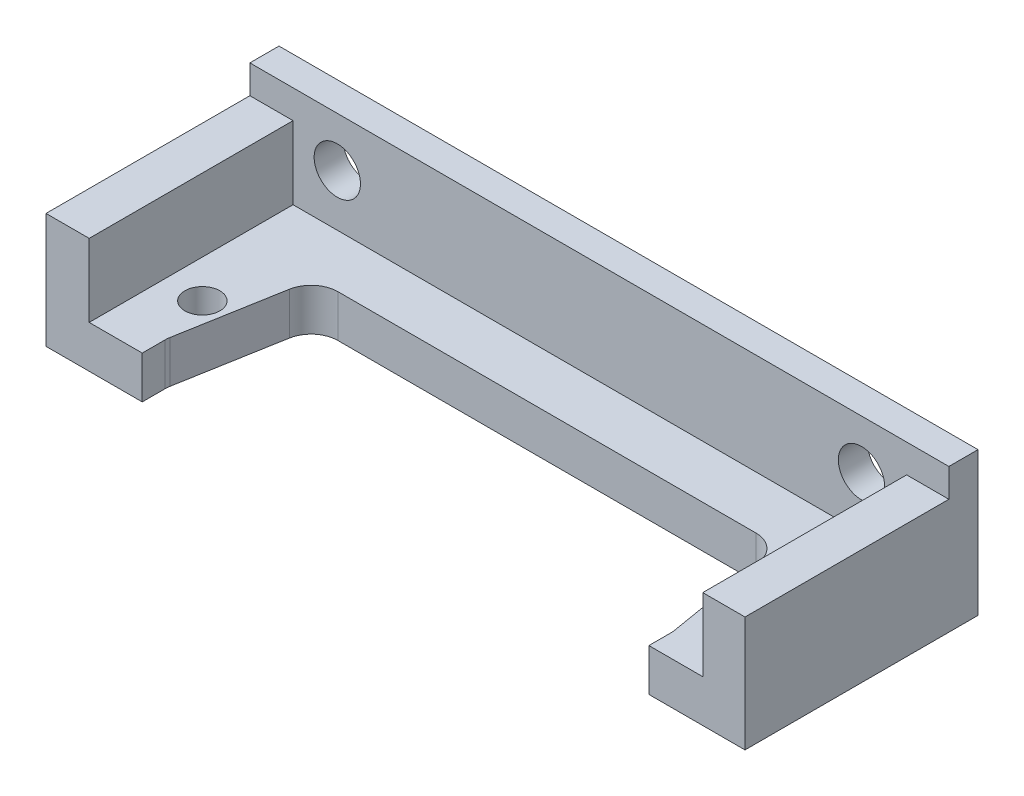
from build123d import *

# Parameters (mm, degrees)
SKETCH1_W           = 55.88
SKETCH1_H           = 9.981767046
SKETCH1_R           = 2.0193
BOSS_EXTRUDE1_DEPTH = 2.54
SKETCH2_W           = 55.88
SKETCH2_H           = 1.152145831
BOSS_EXTRUDE2_DEPTH = 17.78
SKETCH3_W           = 1.2265406
SKETCH3_H           = 17.78
SKETCH3_W_2         = 1.1438128
BOSS_EXTRUDE4_DEPTH = 6.35
SKETCH4_R           = 1.524
CUT_EXTRUDE1_DEPTH  = 105.035332272
CUT_EXTRUDE3_DEPTH  = 105.035332272
BOSS_EXTRUDE5_DEPTH = 2.54
BOSS_EXTRUDE6_DEPTH = 2.54
FILLET1_R           = 2.3368
FILLET2_R           = 2.3368
FILLET3_R           = 2.3368
FILLET4_R           = 2.3368
BOSS_EXTRUDE7_START = 2.54
SKETCH8_R           = 1.524
BOSS_EXTRUDE7_DEPTH = 2.54


with BuildPart() as part:
    # Sketch1 → Boss-Extrude1 (new body)
    with BuildSketch(Plane.XY):
        with Locations((-73.708835459, 211.206122276)):
            Rectangle(SKETCH1_W, SKETCH1_H)
        with Locations((-96.565388679, 211.879005799)):
            Circle(SKETCH1_R, mode=Mode.SUBTRACT)
        with Locations((-50.848835459, 211.879005799)):
            Circle(SKETCH1_R, mode=Mode.SUBTRACT)
    extrude(amount=BOSS_EXTRUDE1_DEPTH)

    # Sketch2 → Boss-Extrude2 (add)
    with BuildSketch(Plane.XY.offset(2.54)):
        with Locations((-73.708835459, 206.791311669)):
            Rectangle(SKETCH2_W, SKETCH2_H)
    extrude(amount=BOSS_EXTRUDE2_DEPTH)

    # Sketch3 → Boss-Extrude4 (add)
    with BuildSketch(Plane(origin=(0, 207.367384584, 0), x_dir=(1, 0, 0), z_dir=(0, 1, 0))):
        with Locations((-101.035565159, -11.43)):
            Rectangle(SKETCH3_W, SKETCH3_H)
        with Locations((-46.340741859, -11.43)):
            Rectangle(SKETCH3_W_2, SKETCH3_H)
    extrude(amount=BOSS_EXTRUDE4_DEPTH)

    # Sketch4 → Cut-Extrude1 (cut, through all)
    with BuildSketch(Plane(origin=(0, 207.367384584, 0), x_dir=(1, 0, 0), z_dir=(0, 1, 0))):
        with Locations(Location((-97.120294859, -13.7541, 0), (0, 0, 270))):
            Circle(SKETCH4_R)
        with Locations(Location((-50.214648259, -13.7541, 0), (0, 0, 270))):
            Circle(SKETCH4_R)
    extrude(amount=-CUT_EXTRUDE1_DEPTH, mode=Mode.SUBTRACT)

    # Sketch5 → Cut-Extrude3 (cut, through all)
    with BuildSketch(Plane(origin=(0, 207.367384584, 0), x_dir=(1, 0, 0), z_dir=(0, 1, 0))):
        Polygon((-53.474471559, -7.1501), (-93.860471559, -7.1501), (-95.795272253, -18.1229), (-95.795272253, -20.32), (-92.955896087, -20.32), (-62.921890572, -20.32), (-51.611648259, -20.32), (-51.611648259, -18.237455367), align=None)
    extrude(amount=-CUT_EXTRUDE3_DEPTH, mode=Mode.SUBTRACT)

    # Sketch6 → Boss-Extrude5 (add)
    with BuildSketch(Plane.ZY.offset(101.648835459)):
        Polygon((2.54, 216.197005799), (0, 216.197005799), (0, 206.215238753), (20.32, 206.215238753), (20.32, 213.717384584), (2.54, 213.717384584), align=None)
    extrude(amount=BOSS_EXTRUDE5_DEPTH)

    # Sketch7 → Boss-Extrude6 (add)
    with BuildSketch(Plane(origin=(-45.768835459, 0, 0), x_dir=(0, 0, -1), z_dir=(1, 0, 0))):
        Polygon((0, 216.197005799), (-2.54, 216.197005799), (-2.54, 213.717384584), (-20.32, 213.717384584), (-20.32, 206.215238753), (0, 206.215238753), align=None)
    extrude(amount=BOSS_EXTRUDE6_DEPTH)

    # Fillet1
    fillet1_edges = [part.edges().sort_by_distance(p)[0] for p in [
        (-93.860471559, 206.791311669, 7.1501),
    ]]
    fillet(fillet1_edges, radius=FILLET1_R)

    # Fillet2
    fillet2_edges = [part.edges().sort_by_distance(p)[0] for p in [
        (-53.474471559, 206.791311669, 7.1501),
    ]]
    fillet(fillet2_edges, radius=FILLET2_R)

    # Fillet3
    fillet3_edges = [part.edges().sort_by_distance(p)[0] for p in [
        (-95.795272253, 206.791311669, 18.1229),
    ]]
    fillet(fillet3_edges, radius=FILLET3_R)

    # Fillet4
    fillet4_edges = [part.edges().sort_by_distance(p)[0] for p in [
        (-51.611648259, 206.791311669, 18.237455367),
    ]]
    fillet(fillet4_edges, radius=FILLET4_R)

    # Sketch8 → Boss-Extrude7 (add)
    with BuildSketch(Plane.XZ.offset(-206.215238753).offset(BOSS_EXTRUDE7_START)):
        with BuildLine():
            Line((-55.451410668, 7.1501), (-91.899663541, 7.1501))
            ThreePointArc((-91.899663541, 7.1501), (-93.401729627, 7.696807345), (-94.200962298, 9.081118938))
            Line((-94.200962298, 9.081118938), (-95.75977101, 17.921562447))
            ThreePointArc((-95.75977101, 17.921562447), (-95.786380023, 18.123677969), (-95.795272253, 18.327343509))
            Line((-95.795272253, 18.327343509), (-95.795272253, 20.32))
            Line((-95.795272253, 20.32), (-104.188835459, 20.32))
            Line((-104.188835459, 20.32), (-104.188835459, 0))
            Line((-104.188835459, 0), (-43.228835459, 0))
            Line((-43.228835459, 0), (-43.228835459, 20.32))
            Line((-43.228835459, 20.32), (-51.611648259, 20.32))
            Line((-51.611648259, 20.32), (-51.611648259, 18.432395976))
            ThreePointArc((-51.611648259, 18.432395976), (-51.619737234, 18.238130166), (-51.64394816, 18.045209281))
            Line((-51.64394816, 18.045209281), (-53.14691057, 9.099713305))
            ThreePointArc((-53.14691057, 9.099713305), (-53.942129983, 7.702885971), (-55.451410668, 7.1501))
        make_face()
        with Locations(Location((-50.214648259, 13.7541, 0), (0, 0, 90))):
            Circle(SKETCH8_R, mode=Mode.SUBTRACT)
        with Locations(Location((-97.120294859, 13.7541, 0), (0, 0, 90))):
            Circle(SKETCH8_R, mode=Mode.SUBTRACT)
    extrude(amount=-BOSS_EXTRUDE7_DEPTH)


solid = part.part
